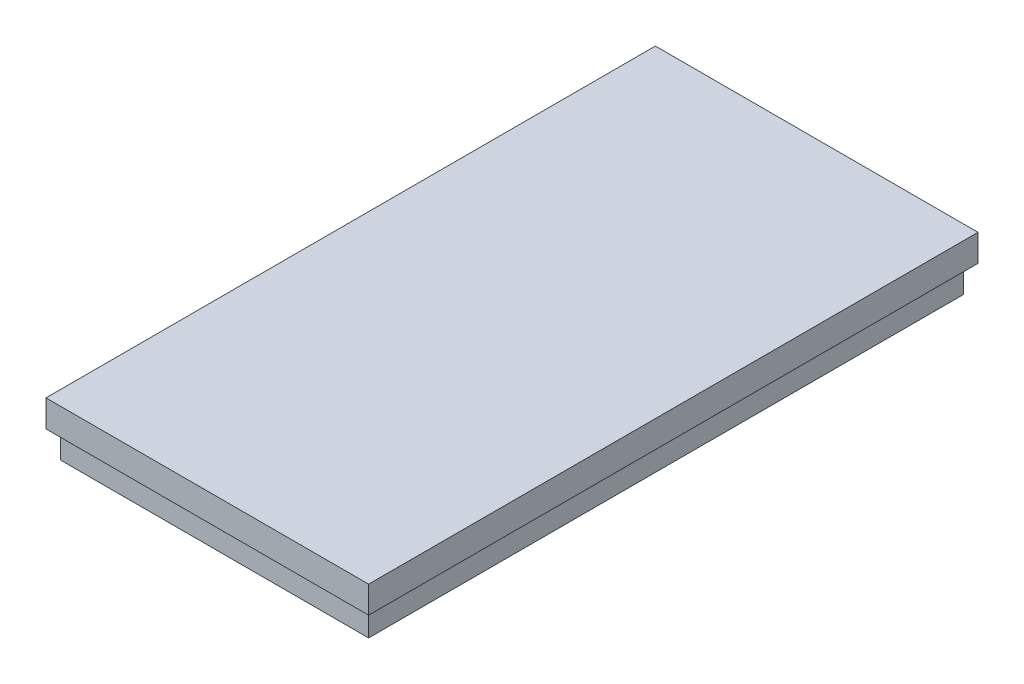
from build123d import *

# Parameters (mm, degrees)
SKETCH1_W           = 90
SKETCH1_H           = 170
BOSS_EXTRUDE1_DEPTH = 7.5
SKETCH2_W           = 86
SKETCH2_H           = 166
BOSS_EXTRUDE2_DEPTH = 7.5
SKETCH5_W           = 72
SKETCH5_H           = 152
CUT_EXTRUDE1_DEPTH  = 7.5


with BuildPart() as part:
    # Sketch1 → Boss-Extrude1 (new body)
    with BuildSketch(Plane(origin=(0, 0, 0), x_dir=(1, 0, 0), z_dir=(0, 1, 0))):
        Rectangle(SKETCH1_W, SKETCH1_H)
    extrude(amount=BOSS_EXTRUDE1_DEPTH)

    # Sketch2 → Boss-Extrude2 (add)
    with BuildSketch(Plane.XZ):
        Rectangle(SKETCH2_W, SKETCH2_H)
    extrude(amount=BOSS_EXTRUDE2_DEPTH)

    # Sketch5 → Cut-Extrude1 (cut)
    with BuildSketch(Plane.XZ.offset(7.5)):
        Rectangle(SKETCH5_W, SKETCH5_H)
    extrude(amount=-CUT_EXTRUDE1_DEPTH, mode=Mode.SUBTRACT)


solid = part.part
